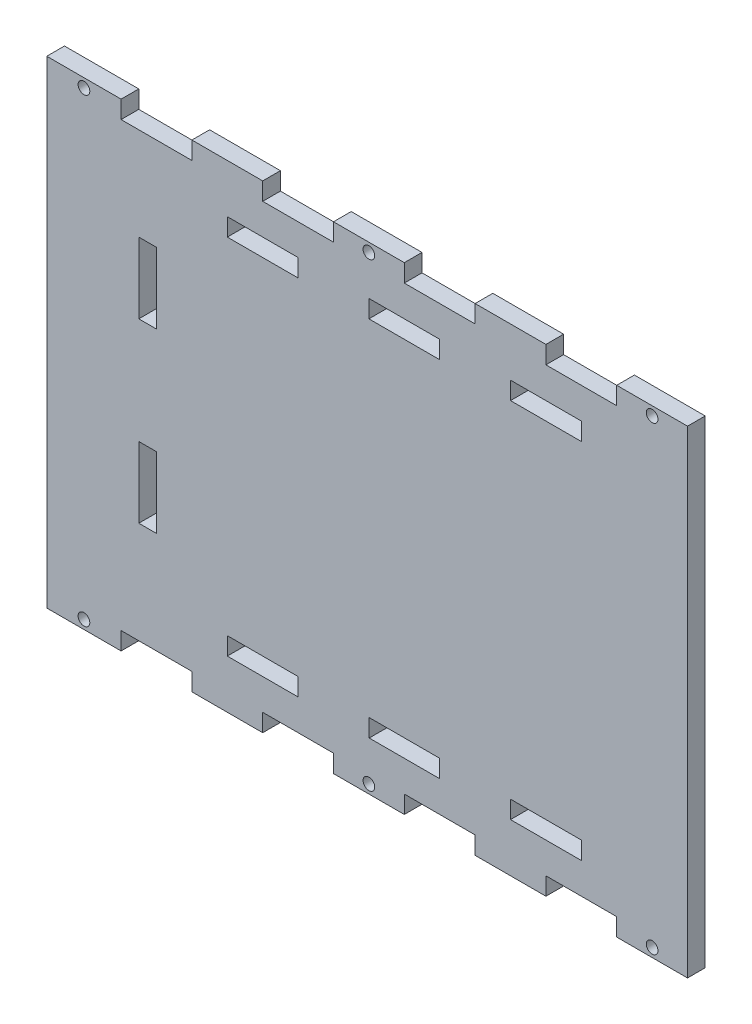
from build123d import *

# Parameters (mm, degrees)
SKETCH1_W           = 229.859874896
SKETCH1_H           = 171.45
BOSS_EXTRUDE1_DEPTH = 6.35
SKETCH2_W           = 25.4
SKETCH2_H           = 6.35
CUT_EXTRUDE1_DEPTH  = 6.35
LPATTERN1_COUNT     = 4
LPATTERN1_PITCH     = 50.8
SKETCH4_R           = 2.0955
CUT_EXTRUDE2_DEPTH  = 209.955242778
SKETCH5_W           = 25.4
SKETCH5_H           = 6.35
SKETCH5_W_2         = 25.290516307
SKETCH5_W_3         = 6.35
SKETCH5_H_2         = 25.4
CUT_EXTRUDE3_DEPTH  = 6.35


with BuildPart() as part:
    # Sketch1 → Boss-Extrude1 (new body)
    with BuildSketch(Plane.XY):
        with Locations((-24.419947229, 69.85)):
            Rectangle(SKETCH1_W, SKETCH1_H)
    extrude(amount=BOSS_EXTRUDE1_DEPTH)

    # Sketch2 → Cut-Extrude1 (cut)
    with BuildSketch(Plane.XY.offset(6.35)):
        with Locations((-99.990009781, -12.7)):
            Rectangle(SKETCH2_W, SKETCH2_H)
        with Locations((-99.990009781, 152.4)):
            Rectangle(SKETCH2_W, SKETCH2_H)
    cut_extrude1 = extrude(amount=-CUT_EXTRUDE1_DEPTH, mode=Mode.SUBTRACT)

    # LPattern1: Cut-Extrude1 ×4
    with Locations(*[(i * LPATTERN1_PITCH, 0, 0) for i in range(1, LPATTERN1_COUNT)]):
        add(cut_extrude1, mode=Mode.SUBTRACT)

    # Sketch4 → Cut-Extrude2 (cut, through all)
    with BuildSketch(Plane(origin=(0, 0, 0), x_dir=(-1, 0, 0), z_dir=(0, 0, -1))):
        with Locations((-77.809990219, -12.7)):
            Circle(SKETCH4_R)
        with Locations((23.790009781, -12.7)):
            Circle(SKETCH4_R)
        with Locations((126.019947229, -12.7)):
            Circle(SKETCH4_R)
        with Locations((126.019947229, 152.4)):
            Circle(SKETCH4_R)
        with Locations((23.790009781, 152.4)):
            Circle(SKETCH4_R)
        with Locations((-77.809990219, 152.4)):
            Circle(SKETCH4_R)
    extrude(amount=-CUT_EXTRUDE2_DEPTH, mode=Mode.SUBTRACT)

    # Sketch5 → Cut-Extrude3 (cut)
    with BuildSketch(Plane(origin=(0, 0, 0), x_dir=(-1, 0, 0), z_dir=(0, 0, -1))):
        with Locations((-39.709990219, 4.7625)):
            Rectangle(SKETCH5_W, SKETCH5_H)
        with Locations((11.035267935, 4.7625)):
            Rectangle(SKETCH5_W_2, SKETCH5_H)
        with Locations((61.890009781, 4.7625)):
            Rectangle(SKETCH5_W, SKETCH5_H)
        with Locations((103.165009781, 39.6875)):
            Rectangle(SKETCH5_W_3, SKETCH5_H_2)
        with Locations((103.165009781, 103.1875)):
            Rectangle(SKETCH5_W_3, SKETCH5_H_2)
        with Locations((61.890009781, 134.9375)):
            Rectangle(SKETCH5_W, SKETCH5_H)
        with Locations((11.090009781, 134.9375)):
            Rectangle(SKETCH5_W, SKETCH5_H)
        with Locations((-39.709990219, 134.9375)):
            Rectangle(SKETCH5_W, SKETCH5_H)
    extrude(amount=-CUT_EXTRUDE3_DEPTH, mode=Mode.SUBTRACT)


solid = part.part
